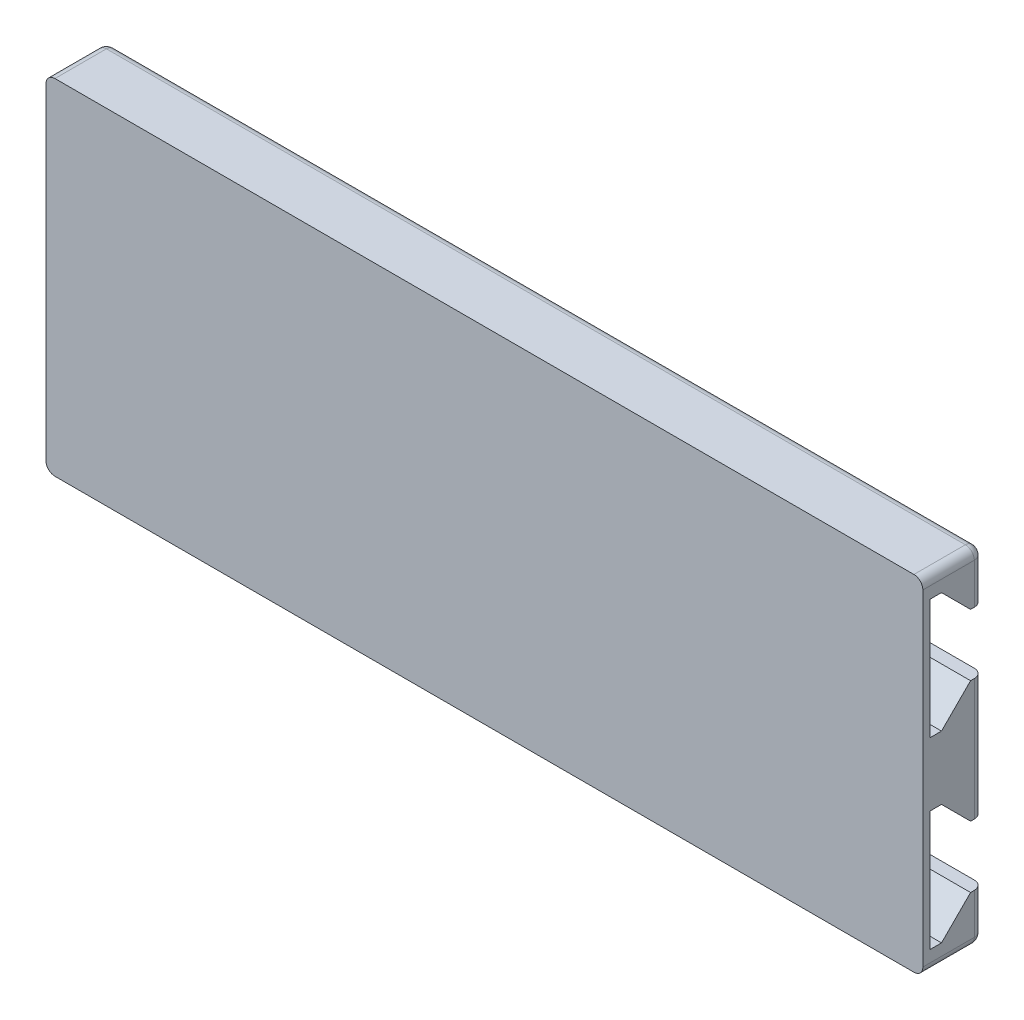
from build123d import *

# Parameters (mm, degrees)
SKETCH1_W           = 77
SKETCH1_H           = 196
BOSS_EXTRUDE1_DEPTH = 13.5
CUT_EXTRUDE1_DEPTH  = 201.201148848
CUT_EXTRUDE2_START  = -72.4
CUT_EXTRUDE2_DEPTH  = 67.8
FILLET1_R           = 2


with BuildPart() as part:
    # Sketch1 → Boss-Extrude1 (new body)
    with BuildSketch(Plane(origin=(0, 0, 0), x_dir=(0, 1, 0), z_dir=(0, 0, 1))):
        Rectangle(SKETCH1_W, SKETCH1_H)
    extrude(amount=BOSS_EXTRUDE1_DEPTH)

    # Sketch2 → Cut-Extrude1 (cut, through all)
    with BuildSketch(Plane(origin=(-98, 0, 0), x_dir=(0, -1, 0), z_dir=(-1, 0, 0))):
        Polygon((13.6, 2.834314575), (13.6, 0), (27.4, 0), (27.4, 2.834314575), (33.9, 9.334314575), (33.9, 11.9), (7.1, 11.9), (7.1, 9.334314575), align=None)
        Polygon((-27.4, 2.834314575), (-27.4, 0), (-13.6, 0), (-13.6, 2.834314575), (-7.1, 9.334314575), (-7.1, 11.9), (-33.9, 11.9), (-33.9, 9.334314575), align=None)
    extrude(amount=-CUT_EXTRUDE1_DEPTH, mode=Mode.SUBTRACT)

    # Sketch3 → Cut-Extrude2 (cut)
    with BuildSketch(Plane.XZ.offset(38.5).offset(CUT_EXTRUDE2_START)):
        Polygon((-80.4, 2.834314575), (-80.4, 0), (-66.6, 0), (-66.6, 2.834314575), (-60.1, 9.334314575), (-60.1, 11.9), (-86.9, 11.9), (-86.9, 9.334314575), align=None)
        Polygon((-31.4, 2.834314575), (-31.4, 0), (-17.6, 0), (-17.6, 2.834314575), (-11.1, 9.334314575), (-11.1, 11.9), (-37.9, 11.9), (-37.9, 9.334314575), align=None)
        Polygon((17.6, 2.834314575), (17.6, 0), (31.4, 0), (31.4, 2.834314575), (37.9, 9.334314575), (37.9, 11.9), (11.1, 11.9), (11.1, 9.334314575), align=None)
        Polygon((66.6, 0), (80.4, 0), (80.4, 2.834314575), (86.9, 9.334314575), (86.9, 11.9), (60.1, 11.9), (60.1, 9.334314575), (66.6, 2.834314575), align=None)
    extrude(amount=CUT_EXTRUDE2_DEPTH, mode=Mode.SUBTRACT)

    # Fillet1
    fillet1_edges = [part.edges().sort_by_distance(p)[0] for p in [
        (98, 0, 0),
        (98, 32.95, 0),
        (-98, 0, 0),
        (-98, -32.95, 0),
        (98, -32.95, 0),
        (0, -38.5, 0),
        (-98, 32.95, 0),
        (0, 38.5, 0),
        (98, 38.5, 6.75),
        (98, -38.5, 6.75),
        (-98, -38.5, 6.75),
        (-98, 38.5, 6.75),
    ]]
    fillet(fillet1_edges, radius=FILLET1_R)


solid = part.part
